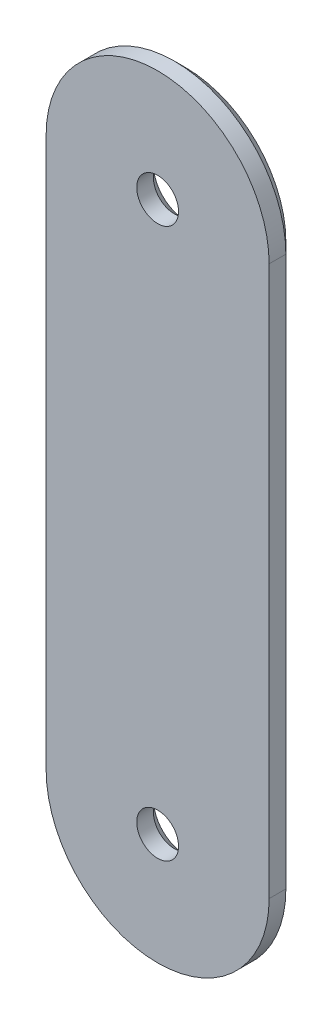
from build123d import *

# Parameters (mm, degrees)
BOSS_EXTRUDE1_DEPTH = 6.35
SKETCH2_R           = 4.7625
CUT_EXTRUDE1_DEPTH  = 153.880572291
CHAMFER1_SIZE       = 2.54


with BuildPart() as part:
    # Sketch1 → Boss-Extrude1 (new body)
    with BuildSketch(Plane(origin=(0, 0, 0), x_dir=(0, 1, 0), z_dir=(0, 0, 1))):
        with BuildLine():
            Line((0, -25.4), (-125.222, -25.4))
            ThreePointArc((-125.222, -25.4), (-150.622, 0), (-125.222, 25.4))
            Line((-125.222, 25.4), (0, 25.4))
            ThreePointArc((0, 25.4), (25.4, 0), (0, -25.4))
        make_face()
    extrude(amount=BOSS_EXTRUDE1_DEPTH)

    # Sketch2 → Cut-Extrude1 (cut, through all)
    with BuildSketch(Plane.XY.offset(6.35)):
        Circle(SKETCH2_R)
        with Locations((0, -125.222)):
            Circle(SKETCH2_R)
    extrude(amount=-CUT_EXTRUDE1_DEPTH, mode=Mode.SUBTRACT)

    # Chamfer1
    chamfer1_edges = [part.edges().sort_by_distance(p)[0] for p in [
        (-4.7625, 0, 0),
        (-4.7625, -125.222, 0),
        (0, 25.4, 0),
        (25.4, -62.611, 0),
        (0, -150.622, 0),
        (-25.4, -62.611, 0),
    ]]
    chamfer(chamfer1_edges, length=CHAMFER1_SIZE)


solid = part.part
